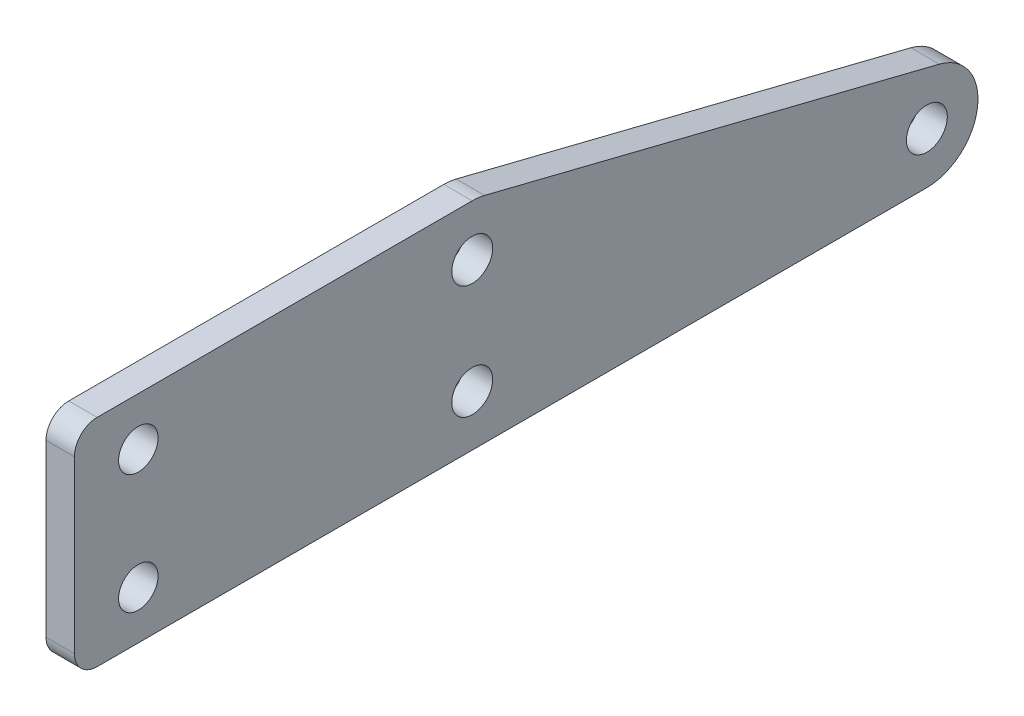
from build123d import *

# Parameters (mm, degrees)
SKETCH1_R           = 2.286
BOSS_EXTRUDE1_DEPTH = 3.175
SKETCH2_R           = 2.20991013
CUT_EXTRUDE1_DEPTH  = 58.875643193


with BuildPart() as part:
    # Sketch1 → Boss-Extrude1 (new body)
    with BuildSketch(Plane(origin=(0, 0, 0), x_dir=(0, 0, -1), z_dir=(1, 0, 0))):
        with BuildLine():
            Line((1.386091097, 11.894364388), (52.186091097, -0.805635612))
            ThreePointArc((52.186091097, -0.805635612), (56.472180686, -7.048277352), (50.8, -12.065))
            Line((50.8, -12.065), (0, -12.065))
            Line((0, -12.065), (-41.91, -12.065))
            ThreePointArc((-41.91, -12.065), (-43.706051224, -11.321051224), (-44.45, -9.525))
            Line((-44.45, -9.525), (-44.45, 9.525))
            ThreePointArc((-44.45, 9.525), (-43.706051224, 11.321051224), (-41.91, 12.065))
            Line((-41.91, 12.065), (0, 12.065))
            ThreePointArc((0, 12.065), (0.698277352, 12.022180686), (1.386091097, 11.894364388))
        make_face()
        with Locations((0, 6.35)):
            Circle(SKETCH1_R, mode=Mode.SUBTRACT)
        with Locations((0, -6.35)):
            Circle(SKETCH1_R, mode=Mode.SUBTRACT)
        with Locations((50.8, -6.35)):
            Circle(SKETCH1_R, mode=Mode.SUBTRACT)
    extrude(amount=BOSS_EXTRUDE1_DEPTH)

    # Sketch2 → Cut-Extrude1 (cut, through all)
    with BuildSketch(Plane(origin=(3.175, 0, 0), x_dir=(0, 0, -1), z_dir=(1, 0, 0))):
        with Locations((-37.310316922, 6.68008987)):
            Circle(SKETCH2_R)
        with Locations((-37.310316922, -6.68008987)):
            Circle(SKETCH2_R)
    extrude(amount=-CUT_EXTRUDE1_DEPTH, mode=Mode.SUBTRACT)


solid = part.part
